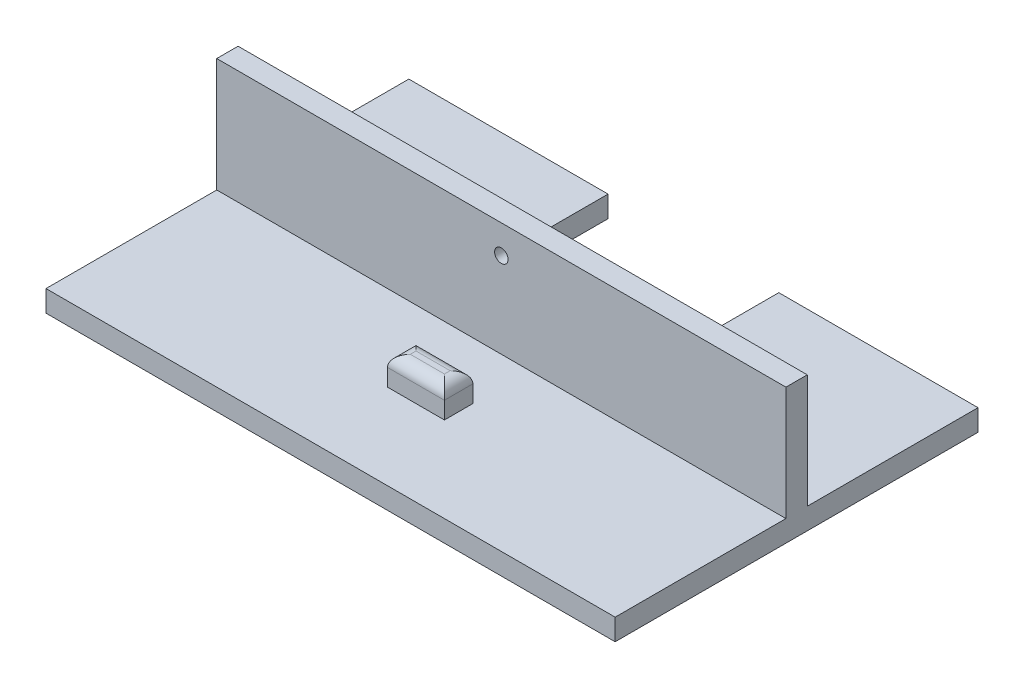
from build123d import *

# Parameters (mm, degrees)
SKETCH1_W           = 38.1
SKETCH1_H           = 4.7625
BOSS_EXTRUDE1_DEPTH = 127
SKETCH2_W           = 12.7
SKETCH2_H           = 6.35
BOSS_EXTRUDE2_DEPTH = 6.35
SKETCH3_R           = 1.499997
CUT_EXTRUDE1_DEPTH  = 138.389847924
FILLET1_R           = 2.54
SKETCH4_W           = 38.1
SKETCH4_H           = 38.1
CUT_EXTRUDE2_DEPTH  = 137.423436059


with BuildPart() as part:
    # Sketch1 → Boss-Extrude1 (new body)
    with BuildSketch(Plane(origin=(0, 0, 0), x_dir=(0, 0, -1), z_dir=(1, 0, 0))):
        Polygon((0, 30.1625), (0, 0), (-42.8625, 0), (-42.8625, 4.7625), (-4.7625, 4.7625), (-4.7625, 30.1625), align=None)
        with Locations((19.05, 2.38125)):
            Rectangle(SKETCH1_W, SKETCH1_H)
    extrude(amount=BOSS_EXTRUDE1_DEPTH)

    # Sketch2 → Boss-Extrude2 (add)
    with BuildSketch(Plane(origin=(0, 4.7625, 0), x_dir=(1, 0, 0), z_dir=(0, 1, 0))):
        with Locations((63.5, -20.6375)):
            Rectangle(SKETCH2_W, SKETCH2_H)
    extrude(amount=BOSS_EXTRUDE2_DEPTH)

    # Sketch3 → Cut-Extrude1 (cut, through all)
    with BuildSketch(Plane.XY.offset(4.7625)):
        with Locations((63.5, 23.8125)):
            Circle(SKETCH3_R)
    extrude(amount=-CUT_EXTRUDE1_DEPTH, mode=Mode.SUBTRACT)

    # Fillet1
    fillet1_edges = [part.edges().sort_by_distance(p)[0] for p in [
        (57.15, 11.1125, 20.6375),
        (63.5, 11.1125, 23.8125),
        (69.85, 11.1125, 20.6375),
        (63.5, 11.1125, 17.4625),
    ]]
    fillet(fillet1_edges, radius=FILLET1_R)

    # Sketch4 → Cut-Extrude2 (cut, through all)
    with BuildSketch(Plane(origin=(0, 4.7625, 0), x_dir=(1, 0, 0), z_dir=(0, 1, 0))):
        with Locations((63.5, 19.05)):
            Rectangle(SKETCH4_W, SKETCH4_H)
    extrude(amount=-CUT_EXTRUDE2_DEPTH, mode=Mode.SUBTRACT)


solid = part.part
